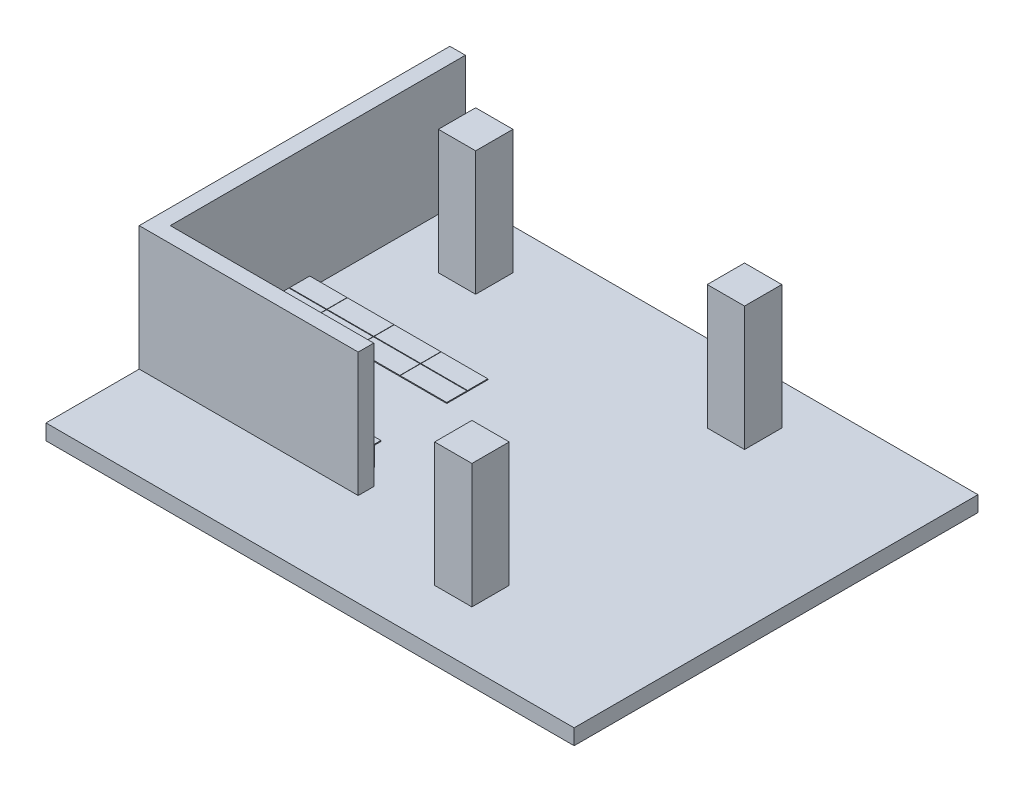
from build123d import *

# Parameters (mm, degrees)
SKETCH_2_W      = 6550
SKETCH_2_H      = 500
SKETCH_2_W_2    = 1200
SKETCH_2_H_2    = 1200
EXTRUDE_5_DEPTH = 4000
SKETCH_3_W      = 17000
SKETCH_3_H      = 13000
EXTRUDE_6_DEPTH = 500
EXTRUDE_START   = 750
SKETCH_4_W      = 1200
SKETCH_4_H      = 650
SKETCH_4_W_2    = 1500
EXTRUDE_7_DEPTH = 30
SKETCH_4_3_W    = 100
SKETCH_4_3_H    = 100
EXTRUDE_8_DEPTH = 720


with BuildPart() as part:
    # 草图2 → 凸台-拉伸5 (new body)
    with BuildSketch(Plane(origin=(0, 0, 0), x_dir=(1, 0, 0), z_dir=(0, 1, 0))):
        Polygon((-500, -500), (0, -500), (0, 0), (0, 9500), (-500, 9500), align=None)
        with Locations((3275, -250)):
            Rectangle(SKETCH_2_W, SKETCH_2_H)
        with Locations((2230, 7600)):
            Rectangle(SKETCH_2_W_2, SKETCH_2_H_2)
        with Locations((10885, 7600)):
            Rectangle(SKETCH_2_W_2, SKETCH_2_H_2)
        with Locations((10885, -1175)):
            Rectangle(SKETCH_2_W_2, SKETCH_2_H_2)
    extrude(amount=EXTRUDE_5_DEPTH)

    # 草图3 → 凸台-拉伸6 (add)
    with BuildSketch(Plane(origin=(0, 0, 0), x_dir=(1, 0, 0), z_dir=(0, 1, 0))):
        with Locations((8000, 3000)):
            Rectangle(SKETCH_3_W, SKETCH_3_H)
    extrude(amount=-EXTRUDE_6_DEPTH)

    # 草图4 → 凸台-拉伸7 (add)
    with BuildSketch(Plane(origin=(0, 0, 0), x_dir=(1, 0, 0), z_dir=(0, 1, 0)).offset(EXTRUDE_START)):
        with Locations((1000, 325)):
            Rectangle(SKETCH_4_W, SKETCH_4_H)
        with Locations((2360, 325)):
            Rectangle(SKETCH_4_W_2, SKETCH_4_H)
        with Locations((5380, 3095)):
            Rectangle(SKETCH_4_W_2, SKETCH_4_H)
        with Locations((3870, 325)):
            Rectangle(SKETCH_4_W_2, SKETCH_4_H)
        with Locations((5380, 325)):
            Rectangle(SKETCH_4_W_2, SKETCH_4_H)
        with Locations((1000, 3095)):
            Rectangle(SKETCH_4_W, SKETCH_4_H)
        with Locations((2360, 3095)):
            Rectangle(SKETCH_4_W_2, SKETCH_4_H)
        with Locations((1000, 3765)):
            Rectangle(SKETCH_4_W, SKETCH_4_H)
        with Locations((3870, 3095)):
            Rectangle(SKETCH_4_W_2, SKETCH_4_H)
        with Locations((2360, 3765)):
            Rectangle(SKETCH_4_W_2, SKETCH_4_H)
        with Locations((3870, 3765)):
            Rectangle(SKETCH_4_W_2, SKETCH_4_H)
        with Locations((5380, 3765)):
            Rectangle(SKETCH_4_W_2, SKETCH_4_H)
    extrude(amount=-EXTRUDE_7_DEPTH)


with BuildPart() as extrude_7_piece_1:
    # of the separate pieces the step leaves, piece 1, a body of its own (extrude_7_pieces)
    add(part.part.solids().sort_by_distance((-500, 0, 500))[0])

    # 草图4<3> → 凸台-拉伸8 (add)
    with BuildSketch(Plane(origin=(0, 0, 0), x_dir=(1, 0, 0), z_dir=(0, 1, 0))):
        with Locations((1450, 500)):
            Rectangle(SKETCH_4_3_W, SKETCH_4_3_H)
        with Locations((550, 500)):
            Rectangle(SKETCH_4_3_W, SKETCH_4_3_H)
        with Locations((550, 150)):
            Rectangle(SKETCH_4_3_W, SKETCH_4_3_H)
        with Locations((1760, 500)):
            Rectangle(SKETCH_4_3_W, SKETCH_4_3_H)
        with Locations((1450, 150)):
            Rectangle(SKETCH_4_3_W, SKETCH_4_3_H)
        with Locations((1760, 150)):
            Rectangle(SKETCH_4_3_W, SKETCH_4_3_H)
        with Locations((2960, 500)):
            Rectangle(SKETCH_4_3_W, SKETCH_4_3_H)
        with Locations((2960, 150)):
            Rectangle(SKETCH_4_3_W, SKETCH_4_3_H)
        with Locations((3270, 500)):
            Rectangle(SKETCH_4_3_W, SKETCH_4_3_H)
        with Locations((3270, 150)):
            Rectangle(SKETCH_4_3_W, SKETCH_4_3_H)
        with Locations((4470, 500)):
            Rectangle(SKETCH_4_3_W, SKETCH_4_3_H)
        with Locations((4470, 150)):
            Rectangle(SKETCH_4_3_W, SKETCH_4_3_H)
        with Locations((4780, 500)):
            Rectangle(SKETCH_4_3_W, SKETCH_4_3_H)
        with Locations((4780, 150)):
            Rectangle(SKETCH_4_3_W, SKETCH_4_3_H)
        with Locations((5980, 500)):
            Rectangle(SKETCH_4_3_W, SKETCH_4_3_H)
        with Locations((5980, 150)):
            Rectangle(SKETCH_4_3_W, SKETCH_4_3_H)
    extrude(amount=EXTRUDE_8_DEPTH)


with BuildPart() as extrude_7_piece_2:
    # of the separate pieces the step leaves, piece 2, a body of its own (extrude_7_pieces)
    add(part.part.solids().sort_by_distance((4620, 750, -4090))[0])


with BuildPart() as extrude_7_piece_3:
    # of the separate pieces the step leaves, piece 3, a body of its own (extrude_7_pieces)
    add(part.part.solids().sort_by_distance((1610, 750, -3420))[0])


with BuildPart() as extrude_7_piece_4:
    # of the separate pieces the step leaves, piece 4, a body of its own (extrude_7_pieces)
    add(part.part.solids().sort_by_distance((4620, 750, -3420))[0])


with BuildPart() as extrude_7_piece_5:
    # of the separate pieces the step leaves, piece 5, a body of its own (extrude_7_pieces)
    add(part.part.solids().sort_by_distance((3110, 750, -4090))[0])


with BuildPart() as extrude_7_piece_6:
    # of the separate pieces the step leaves, piece 6, a body of its own (extrude_7_pieces)
    add(part.part.solids().sort_by_distance((6130, 750, -4090))[0])


with BuildPart() as extrude_7_piece_7:
    # of the separate pieces the step leaves, piece 7, a body of its own (extrude_7_pieces)
    add(part.part.solids().sort_by_distance((6130, 750, -3420))[0])


with BuildPart() as extrude_7_piece_8:
    # of the separate pieces the step leaves, piece 8, a body of its own (extrude_7_pieces)
    add(part.part.solids().sort_by_distance((1600, 750, -4090))[0])


with BuildPart() as extrude_7_piece_9:
    # of the separate pieces the step leaves, piece 9, a body of its own (extrude_7_pieces)
    add(part.part.solids().sort_by_distance((1600, 750, -3420))[0])


solid = Compound([extrude_7_piece_1.part, extrude_7_piece_2.part, extrude_7_piece_3.part, extrude_7_piece_4.part, extrude_7_piece_5.part, extrude_7_piece_6.part, extrude_7_piece_7.part, extrude_7_piece_8.part, extrude_7_piece_9.part])
